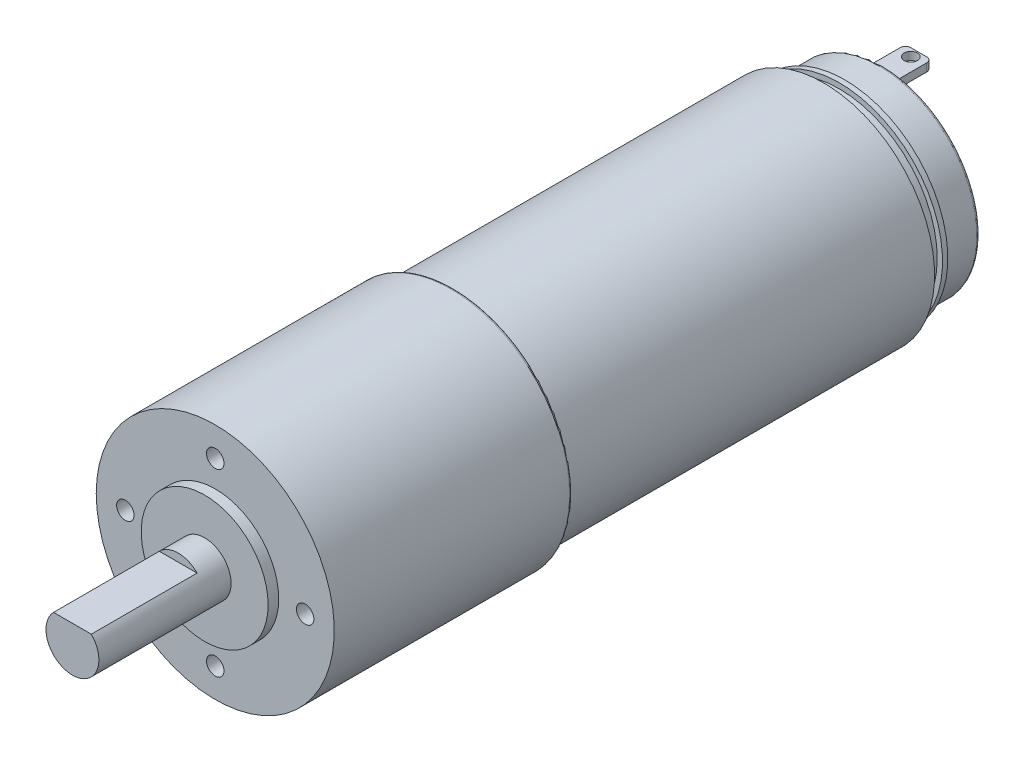
from build123d import *

# Parameters (mm, degrees)
SKETCH2_R             = 22.5
BOSS_EXTRUDE2_DEPTH   = 45
M4_TAPPED_HOLE2_D     = 3.3
M4_TAPPED_HOLE2_DEPTH = 10.1
M4_TAPPED_HOLE2_TIP   = 0.991420021
SKETCH6_R             = 12
BOSS_EXTRUDE3_DEPTH   = 2
SKETCH7_R             = 5
BOSS_EXTRUDE4_DEPTH   = 25
CUT_EXTRUDE1_START    = -20
CUT_EXTRUDE1_DEPTH    = 20
SKETCH9_R             = 21
BOSS_EXTRUDE5_DEPTH   = 70
SKETCH10_R            = 18.5
BOSS_EXTRUDE6_DEPTH   = 3
SKETCH11_R            = 19.5
BOSS_EXTRUDE7_DEPTH   = 1
SKETCH12_R            = 18.5
BOSS_EXTRUDE8_DEPTH   = 7
SKETCH13_W            = 5
SKETCH13_H            = 1.5
BOSS_EXTRUDE9_DEPTH   = 7
SKETCH14_R            = 1.25
CUT_EXTRUDE2_DEPTH    = 100.047968177
FILLET1_R             = 1
FILLET2_R             = 0.5
FILLET3_R             = 0.5


with BuildPart() as part:
    # Sketch2 → Boss-Extrude2 (new body)
    with BuildSketch(Plane.XY):
        with Locations(Location((0, 0, 0), (0, 0, 180))):
            Circle(SKETCH2_R)
    extrude(amount=BOSS_EXTRUDE2_DEPTH)

    # M4 Tapped Hole2
    with Locations(Plane(origin=(0, 17, 45), x_dir=(1, 0, 0), z_dir=(0, 0, 1))):
        with Locations((0, 0), (17, -17), (0, -34), (-17, -17)):
            Hole(M4_TAPPED_HOLE2_D / 2, depth=M4_TAPPED_HOLE2_DEPTH)
            with Locations((0, 0, -(M4_TAPPED_HOLE2_DEPTH + M4_TAPPED_HOLE2_TIP / 2))):  # 118° drill point
                Cone(0, M4_TAPPED_HOLE2_D / 2, M4_TAPPED_HOLE2_TIP, mode=Mode.SUBTRACT)

    # Sketch6 → Boss-Extrude3 (add)
    with BuildSketch(Plane.XY.offset(45)):
        Circle(SKETCH6_R)
    extrude(amount=BOSS_EXTRUDE3_DEPTH)

    # Sketch7 → Boss-Extrude4 (add)
    with BuildSketch(Plane.XY.offset(47)):
        Circle(SKETCH7_R)
    extrude(amount=BOSS_EXTRUDE4_DEPTH)

    # Sketch8 → Cut-Extrude1 (cut)
    with BuildSketch(Plane.XY.offset(72).offset(CUT_EXTRUDE1_START)):
        with BuildLine():
            Line((-3.570714214, 3.5), (3.570714214, 3.5))
            ThreePointArc((3.570714214, 3.5), (0, 5), (-3.570714214, 3.5))
        make_face()
    extrude(amount=CUT_EXTRUDE1_DEPTH, mode=Mode.SUBTRACT)

    # Sketch9 → Boss-Extrude5 (add)
    with BuildSketch(Plane(origin=(0, 0, 0), x_dir=(-1, 0, 0), z_dir=(0, 0, -1))):
        Circle(SKETCH9_R)
    extrude(amount=BOSS_EXTRUDE5_DEPTH)

    # Sketch10 → Boss-Extrude6 (add)
    with BuildSketch(Plane(origin=(0, 0, -70), x_dir=(-1, 0, 0), z_dir=(0, 0, -1))):
        Circle(SKETCH10_R)
    extrude(amount=BOSS_EXTRUDE6_DEPTH)

    # Sketch11 → Boss-Extrude7 (add)
    with BuildSketch(Plane(origin=(0, 0, -73), x_dir=(-1, 0, 0), z_dir=(0, 0, -1))):
        Circle(SKETCH11_R)
    extrude(amount=BOSS_EXTRUDE7_DEPTH)

    # Sketch12 → Boss-Extrude8 (add)
    with BuildSketch(Plane(origin=(0, 0, -74), x_dir=(-1, 0, 0), z_dir=(0, 0, -1))):
        Circle(SKETCH12_R)
    extrude(amount=BOSS_EXTRUDE8_DEPTH)

    # Sketch13 → Boss-Extrude9 (add)
    with BuildSketch(Plane(origin=(0, 0, -81), x_dir=(-1, 0, 0), z_dir=(0, 0, -1))):
        with Locations((0, -16.25)):
            Rectangle(SKETCH13_W, SKETCH13_H)
        with Locations((0, 16.25)):
            Rectangle(SKETCH13_W, SKETCH13_H)
    extrude(amount=BOSS_EXTRUDE9_DEPTH)

    # Sketch14 → Cut-Extrude2 (cut, through all)
    with BuildSketch(Plane.XZ.offset(17)):
        with Locations(Location((0, -86.5, 0), (0, 0, 270))):
            Circle(SKETCH14_R)
    extrude(amount=-CUT_EXTRUDE2_DEPTH, mode=Mode.SUBTRACT)

    # Fillet1
    fillet1_edges = [part.edges().sort_by_distance(p)[0] for p in [
        (2.5, 16.25, -88),
        (-2.5, 16.25, -88),
        (-2.5, -16.25, -88),
        (2.5, -16.25, -88),
    ]]
    fillet(fillet1_edges, radius=FILLET1_R)

    # Fillet2
    fillet2_edges = [part.edges().sort_by_distance(p)[0] for p in [
        (18.5, 0, -81),
    ]]
    fillet(fillet2_edges, radius=FILLET2_R)

    # Fillet3
    fillet3_edges = [part.edges().sort_by_distance(p)[0] for p in [
        (22.5, 0, 0),
    ]]
    fillet(fillet3_edges, radius=FILLET3_R)


solid = part.part
